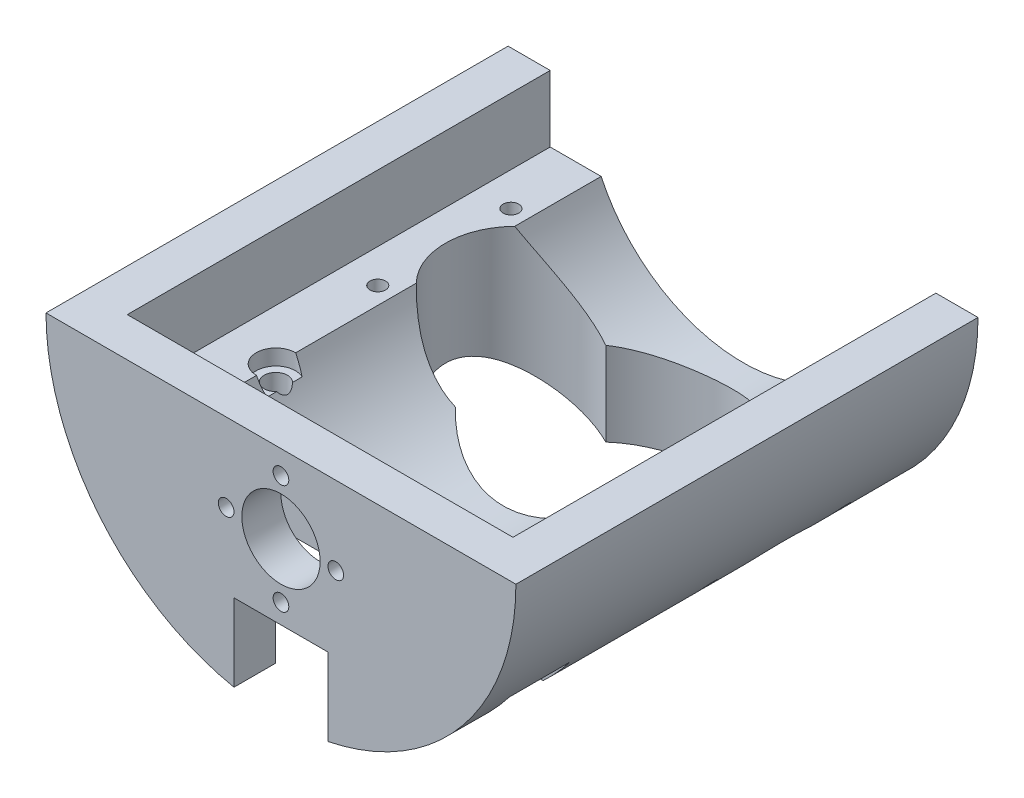
from build123d import *

# Parameters (mm, degrees)
BOSS_EXTRUDE1_DEPTH      = 22
BOSS_EXTRUDE1_DEPTH_BACK = 37
SKETCH2_R                = 30
CUT_EXTRUDE2_DEPTH       = 57.29387178
CUT_EXTRUDE2_DEPTH_BACK  = 57.29387178
SKETCH1_R                = 1
SKETCH1_R_2              = 1.5
SKETCH1_W                = 47.646990254
SKETCH1_H                = 7.750586204
CUT_EXTRUDE3_DEPTH       = 77
CUT_EXTRUDE4_DEPTH       = 57.293871958
CUT_EXTRUDE4_DEPTH_BACK  = 57.293871958
SKETCH4_W                = 20
SKETCH4_H                = 8
CUT_EXTRUDE5_DEPTH       = 73.670489364
CUT_EXTRUDE5_DEPTH_BACK  = 14
SKETCH5_R                = 5
SKETCH5_R_2              = 1
CUT_EXTRUDE7_DEPTH       = 54
SKETCH8_W                = 49.246263316
SKETCH8_H                = 16.932574342
CUT_EXTRUDE8_DEPTH       = 54
SKETCH9_R                = 2.5
CUT_EXTRUDE9_DEPTH       = 2
SKETCH10_W               = 12
SKETCH10_H               = 21
CUT_EXTRUDE10_DEPTH      = 8


with BuildPart() as part:
    # Sketch2 → Boss-Extrude1 (new, two sides: drawn at the far end of the back side and taken through both)
    with BuildSketch(Plane.XY.offset(-BOSS_EXTRUDE1_DEPTH_BACK)):
        Circle(SKETCH2_R)
    extrude(amount=BOSS_EXTRUDE1_DEPTH + BOSS_EXTRUDE1_DEPTH_BACK)

    # Sketch1 → Cut-Extrude2 (cut, two sides: drawn at the far end of the back side and taken through both)
    with BuildSketch(Plane(origin=(0, 0, 0), x_dir=(1, 0, 0), z_dir=(0, 1, 0)).offset(-CUT_EXTRUDE2_DEPTH_BACK)):
        with Locations(Location((-20.32, 27.68, 0), (0, 0, 270))):
            Circle(SKETCH1_R)
        with Locations(Location((21.68, 27.68, 0), (0, 0, 270))):
            Circle(SKETCH1_R)
        with Locations(Location((21.68, 10.68, 0), (0, 0, 270))):
            Circle(SKETCH1_R)
        with Locations(Location((-20.32, 10.68, 0), (0, 0, 270))):
            Circle(SKETCH1_R)
        with Locations(Location((-18.15, -4.5, 0), (0, 0, 270))):
            Circle(SKETCH1_R_2)
        with Locations(Location((18.15, -4.5, 0), (0, 0, 270))):
            Circle(SKETCH1_R_2)
        with Locations((0, -12.79952025)):
            Rectangle(SKETCH1_W, SKETCH1_H)
        with BuildLine():
            ThreePointArc((10.68981817, 28.168746234), (22.632501649, 20.603425267), (12.485520614, 10.759617777))
            ThreePointArc((12.485520614, 10.759617777), (1, 5.831595296), (-10.485520614, 10.759617777))
            ThreePointArc((-10.485520614, 10.759617777), (-20.632501649, 20.603425267), (-8.68981817, 28.168746234))
            ThreePointArc((-8.68981817, 28.168746234), (1, 33.341749606), (10.68981817, 28.168746234))
        make_face()
    extrude(amount=CUT_EXTRUDE2_DEPTH + CUT_EXTRUDE2_DEPTH_BACK, mode=Mode.SUBTRACT)

    # Sketch3 → Cut-Extrude3 (cut)
    with BuildSketch(Plane(origin=(0, 0, -37), x_dir=(-1, 0, 0), z_dir=(0, 0, -1))):
        with BuildLine():
            Line((-30, 0), (30, 0))
            ThreePointArc((30, 0), (0, 30), (-30, 0))
        make_face()
    extrude(amount=-CUT_EXTRUDE3_DEPTH, mode=Mode.SUBTRACT)

    # Sketch4 → Cut-Extrude4 (cut, two sides: drawn at the far end of the back side and taken through both)
    with BuildSketch(Plane(origin=(0, 0, 0), x_dir=(0, 0, -1), z_dir=(1, 0, 0)).offset(-CUT_EXTRUDE4_DEPTH_BACK)):
        with Locations((-6.674813352, -26)):
            Rectangle(SKETCH4_W, SKETCH4_H)
    extrude(amount=CUT_EXTRUDE4_DEPTH + CUT_EXTRUDE4_DEPTH_BACK, mode=Mode.SUBTRACT)

    # Sketch5 → Cut-Extrude5 (cut, two sides: drawn at the far end of the back side and taken through both)
    with BuildSketch(Plane(origin=(0, 0, 22), x_dir=(-1, 0, 0), z_dir=(0, 0, -1)).offset(-CUT_EXTRUDE5_DEPTH_BACK)):
        with Locations(Location((0, -10, 0), (0, 0, 180))):
            Circle(SKETCH5_R)
        with Locations(Location((-7, -10, 0), (0, 0, 180))):
            Circle(SKETCH5_R_2)
        with Locations(Location((0, -3, 0), (0, 0, 180))):
            Circle(SKETCH5_R_2)
        with Locations(Location((7, -10, 0), (0, 0, 180))):
            Circle(SKETCH5_R_2)
        with Locations(Location((0, -17, 0), (0, 0, 180))):
            Circle(SKETCH5_R_2)
    extrude(amount=CUT_EXTRUDE5_DEPTH + CUT_EXTRUDE5_DEPTH_BACK, mode=Mode.SUBTRACT)

    # Sketch7 → Cut-Extrude7 (cut)
    with BuildSketch(Plane(origin=(0, 0, -37), x_dir=(-1, 0, 0), z_dir=(0, 0, -1))):
        with BuildLine():
            Line((-20, 0), (20, 0))
            ThreePointArc((20, 0), (0, -20), (-20, 0))
        make_face()
    extrude(amount=-CUT_EXTRUDE7_DEPTH, mode=Mode.SUBTRACT)

    # Sketch8 → Cut-Extrude8 (cut)
    with BuildSketch(Plane(origin=(0, 0, -37), x_dir=(-1, 0, 0), z_dir=(0, 0, -1))):
        Rectangle(SKETCH8_W, SKETCH8_H)
    extrude(amount=-CUT_EXTRUDE8_DEPTH, mode=Mode.SUBTRACT)

    # Sketch9 → Cut-Extrude9 (cut)
    with BuildSketch(Plane(origin=(0, -8.466287171, 0), x_dir=(1, 0, 0), z_dir=(0, 1, 0))):
        with Locations((18.15, -4.5)):
            Circle(SKETCH9_R)
        with Locations((-18.15, -4.5)):
            Circle(SKETCH9_R)
    extrude(amount=-CUT_EXTRUDE9_DEPTH, mode=Mode.SUBTRACT)

    # Sketch10 → Cut-Extrude10 (cut)
    with BuildSketch(Plane.XY.offset(22)):
        with Locations((0, -30)):
            Rectangle(SKETCH10_W, SKETCH10_H)
    extrude(amount=-CUT_EXTRUDE10_DEPTH, mode=Mode.SUBTRACT)


solid = part.part
